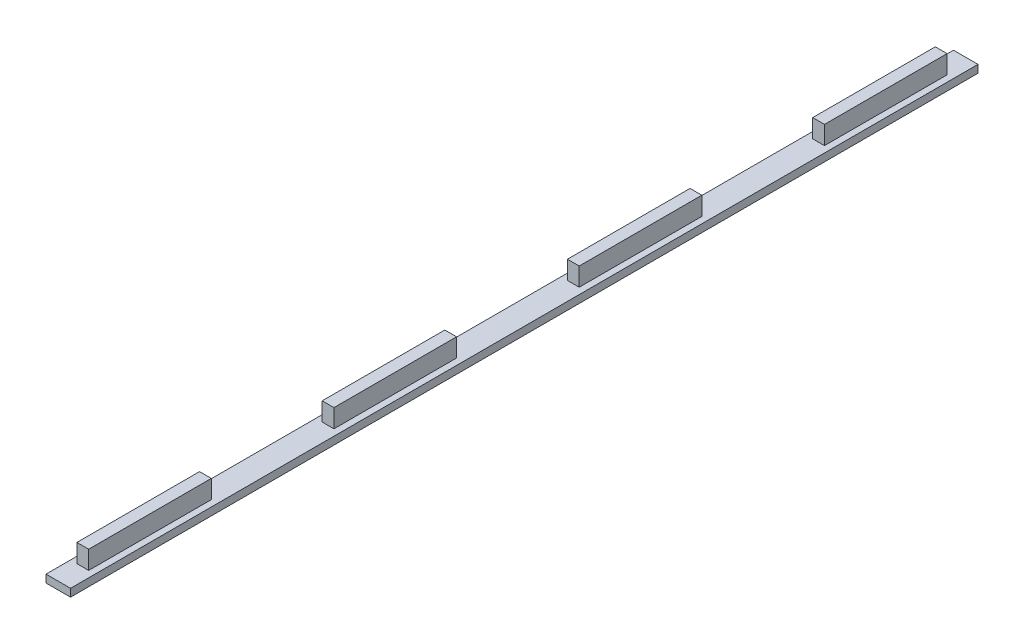
from build123d import *

# Parameters (mm, degrees)
SKETCH1_W           = 1.524
SKETCH1_H           = 31.75
BOSS_EXTRUDE1_DEPTH = 2
BOSS_EXTRUDE2_START = 2
SKETCH1_3_W         = 1.524
SKETCH1_3_H         = 31.75
BOSS_EXTRUDE2_DEPTH = 4.7625


with BuildPart() as part:
    # Sketch1 → Boss-Extrude1 (new body)
    with BuildSketch(Plane(origin=(0, 0, 0), x_dir=(1, 0, 0), z_dir=(0, 1, 0))):
        Polygon((3.175, 117.475), (0, 117.475), (0, 111.125), (1.524, 111.125), (1.524, 79.375), (1.524, 47.625), (1.524, 15.875), (1.524, -15.875), (1.524, -47.625), (1.524, -79.375), (1.524, -111.125), (0, -111.125), (0, -117.475), (3.175, -117.475), align=None)
        Polygon((0, 111.125), (0, 117.475), (-3.175, 117.475), (-3.175, -117.475), (0, -117.475), (0, -111.125), (-1.524, -111.125), (-1.524, -79.375), (-1.524, -47.625), (-1.524, -15.875), (-1.524, 15.875), (-1.524, 47.625), (-1.524, 79.375), (-1.524, 111.125), align=None)
        with Locations((-0.762, 95.25)):
            Rectangle(SKETCH1_W, SKETCH1_H)
        with Locations((0.762, 95.25)):
            Rectangle(SKETCH1_W, SKETCH1_H)
        with Locations((0.762, 63.5)):
            Rectangle(SKETCH1_W, SKETCH1_H)
        with Locations((-0.762, 63.5)):
            Rectangle(SKETCH1_W, SKETCH1_H)
        with Locations((-0.762, 31.75)):
            Rectangle(SKETCH1_W, SKETCH1_H)
        with Locations((0.762, 31.75)):
            Rectangle(SKETCH1_W, SKETCH1_H)
        with Locations((0.762, 0)):
            Rectangle(SKETCH1_W, SKETCH1_H)
        with Locations((-0.762, 0)):
            Rectangle(SKETCH1_W, SKETCH1_H)
        with Locations((0.762, -63.5)):
            Rectangle(SKETCH1_W, SKETCH1_H)
        with Locations((-0.762, -63.5)):
            Rectangle(SKETCH1_W, SKETCH1_H)
        with Locations((-0.762, -95.25)):
            Rectangle(SKETCH1_W, SKETCH1_H)
        with Locations((0.762, -95.25)):
            Rectangle(SKETCH1_W, SKETCH1_H)
        with Locations((0.762, -31.75)):
            Rectangle(SKETCH1_W, SKETCH1_H)
        with Locations((-0.762, -31.75)):
            Rectangle(SKETCH1_W, SKETCH1_H)
    extrude(amount=BOSS_EXTRUDE1_DEPTH)

    # Sketch1<3> → Boss-Extrude2 (add)
    with BuildSketch(Plane(origin=(0, 0, 0), x_dir=(1, 0, 0), z_dir=(0, 1, 0)).offset(BOSS_EXTRUDE2_START)):
        with Locations((0.762, 95.25)):
            Rectangle(SKETCH1_3_W, SKETCH1_3_H)
        with Locations((-0.762, 95.25)):
            Rectangle(SKETCH1_3_W, SKETCH1_3_H)
        with Locations((0.762, 31.75)):
            Rectangle(SKETCH1_3_W, SKETCH1_3_H)
        with Locations((-0.762, 31.75)):
            Rectangle(SKETCH1_3_W, SKETCH1_3_H)
        with Locations((0.762, -31.75)):
            Rectangle(SKETCH1_3_W, SKETCH1_3_H)
        with Locations((-0.762, -31.75)):
            Rectangle(SKETCH1_3_W, SKETCH1_3_H)
        with Locations((0.762, -95.25)):
            Rectangle(SKETCH1_3_W, SKETCH1_3_H)
        with Locations((-0.762, -95.25)):
            Rectangle(SKETCH1_3_W, SKETCH1_3_H)
    extrude(amount=BOSS_EXTRUDE2_DEPTH)


solid = part.part
